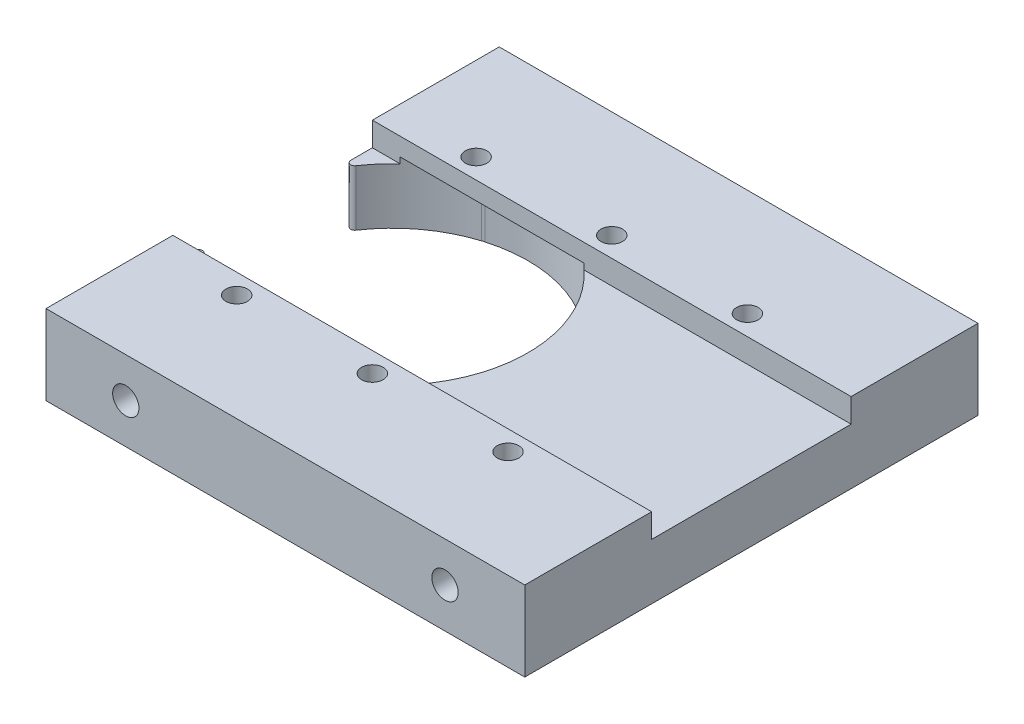
from build123d import *
from build123d.topology import SkipClean

# Parameters (mm, degrees)
EXTRUDE_3_DEPTH     = 7
EXTRUDE_4_DEPTH     = 0.75
EXTRUDE_5_DEPTH     = 0.75
SKETCH_6_W          = 60
SKETCH_6_H          = 15.9
SKETCH_6_R          = 1.35
EXTRUDE_6_DEPTH     = 2.25
SKETCH_7_W          = 60
SKETCH_7_H          = 15.9
SKETCH_7_R          = 1.35
EXTRUDE_7_DEPTH     = 2.25
SKETCH_8_R          = 1.65
CUT_EXTRUDE_1_DEPTH = 5
CUT_EXTRUDE_START   = -5
SKETCH_9_R          = 1.65
CUT_EXTRUDE_2_DEPTH = 5


with BuildPart() as part:
    # 草图1 → 凸台-拉伸3 (new body)
    with BuildSketch(Plane(origin=(0, 0, 0), x_dir=(1, 0, 0), z_dir=(0, 1, 0))):
        with BuildLine():
            Line((-36.072982456, 22.421052632), (-36.072982456, 3.819011603))
            ThreePointArc((-36.072982456, 3.819011603), (-35.719367467, 3.340920159), (-35.158696742, 3.539069918))
            ThreePointArc((-35.158696742, 3.539069918), (-31.213626847, 7.665367614), (-26.125018269, 10.253025221))
            ThreePointArc((-26.125018269, 10.253025221), (-25.960902102, 10.314118117), (-25.79025857, 10.353453131))
            ThreePointArc((-25.79025857, 10.353453131), (-19.301572904, 10.928509809), (-13.072982456, 9.021052632))
            ThreePointArc((-13.072982456, 9.021052632), (-5.321033393, -12.372389376), (-25.79025857, -22.311347868))
            ThreePointArc((-25.79025857, -22.311347868), (-25.960902102, -22.272012853), (-26.125018269, -22.210919958))
            ThreePointArc((-26.125018269, -22.210919958), (-31.213626847, -19.623262351), (-35.158696742, -15.496964655))
            ThreePointArc((-35.158696742, -15.496964655), (-35.719367467, -15.298814896), (-36.072982456, -15.77690634))
            Line((-36.072982456, -15.77690634), (-36.072982456, -34.378947368))
            Line((-36.072982456, -34.378947368), (23.927017544, -34.378947368))
            Line((23.927017544, -34.378947368), (23.927017544, 22.421052632))
            Line((23.927017544, 22.421052632), (-36.072982456, 22.421052632))
        make_face()
    extrude(amount=EXTRUDE_3_DEPTH)

    # 草图5 → 凸台-拉伸4 (add)
    with BuildSketch(Plane(origin=(0, 7, 0), x_dir=(1, 0, 0), z_dir=(0, 1, 0))):
        with BuildLine():
            Line((-36.072982456, -34.378947368), (23.927017544, -34.378947368))
            Line((23.927017544, -34.378947368), (23.927017544, -18.478947368))
            Line((23.927017544, -18.478947368), (-9.551263834, -18.478947368))
            ThreePointArc((-9.551263834, -18.478947368), (-17.168250345, -22.524432165), (-25.79025857, -22.311347868))
            ThreePointArc((-25.79025857, -22.311347868), (-25.960902102, -22.272012853), (-26.125018269, -22.210919958))
            ThreePointArc((-26.125018269, -22.210919958), (-29.567347581, -20.704631092), (-32.594701078, -18.478947368))
            Line((-32.594701078, -18.478947368), (-36.072982456, -18.478947368))
            Line((-36.072982456, -18.478947368), (-36.072982456, -34.378947368))
        make_face()
    extrude(amount=EXTRUDE_4_DEPTH)

    # 草图5<3> → 凸台-拉伸5 (add)
    with BuildSketch(Plane(origin=(0, 7, 0), x_dir=(1, 0, 0), z_dir=(0, 1, 0))):
        with BuildLine():
            Line((-9.551263834, 6.521052632), (23.927017544, 6.521052632))
            Line((23.927017544, 6.521052632), (23.927017544, 22.421052632))
            Line((23.927017544, 22.421052632), (-36.072982456, 22.421052632))
            Line((-36.072982456, 22.421052632), (-36.072982456, 6.521052632))
            Line((-36.072982456, 6.521052632), (-32.594701078, 6.521052632))
            ThreePointArc((-32.594701078, 6.521052632), (-29.567347581, 8.746736355), (-26.125018269, 10.253025221))
            ThreePointArc((-26.125018269, 10.253025221), (-25.960902102, 10.314118117), (-25.79025857, 10.353453131))
            ThreePointArc((-25.79025857, 10.353453131), (-17.168250345, 10.566537428), (-9.551263834, 6.521052632))
        make_face()
    extrude(amount=EXTRUDE_5_DEPTH)

    # 草图6 → 凸台-拉伸6 (add)
    with SkipClean():  # the faces are left unmerged after this step: merging them gives an invalid solid
        with BuildSketch(Plane(origin=(0, 7.75, 0), x_dir=(1, 0, 0), z_dir=(0, 1, 0))):
            with Locations((-6.072982456, -26.428947368)):
                Rectangle(SKETCH_6_W, SKETCH_6_H)
            with Locations((-25.572982456, -20.978947368)):
                Circle(SKETCH_6_R, mode=Mode.SUBTRACT)
            with Locations((-8.572982456, -20.978947368)):
                Circle(SKETCH_6_R, mode=Mode.SUBTRACT)
            with Locations((8.427017544, -20.978947368)):
                Circle(SKETCH_6_R, mode=Mode.SUBTRACT)
        extrude(amount=EXTRUDE_6_DEPTH)

    # 草图7 → 凸台-拉伸7 (add)
    with SkipClean():  # the faces are left unmerged after this step: merging them gives an invalid solid
        with BuildSketch(Plane(origin=(0, 7.75, 0), x_dir=(1, 0, 0), z_dir=(0, 1, 0))):
            with Locations((-6.072982456, 14.471052632)):
                Rectangle(SKETCH_7_W, SKETCH_7_H)
            with Locations((8.427017544, 9.021052632)):
                Circle(SKETCH_7_R, mode=Mode.SUBTRACT)
            with Locations((-8.572982456, 9.021052632)):
                Circle(SKETCH_7_R, mode=Mode.SUBTRACT)
            with Locations((-25.572982456, 9.021052632)):
                Circle(SKETCH_7_R, mode=Mode.SUBTRACT)
        extrude(amount=EXTRUDE_7_DEPTH)

    # 草图8 → 切除-拉伸1 (cut)
    with SkipClean():  # the faces are left unmerged after this step: merging them gives an invalid solid
        with BuildSketch(Plane.XY.offset(34.378947368)):
            with Locations((-26.072982456, 5)):
                Circle(SKETCH_8_R)
            with Locations((13.927017544, 5)):
                Circle(SKETCH_8_R)
        extrude(amount=-CUT_EXTRUDE_1_DEPTH, mode=Mode.SUBTRACT)

    # 草图9 → 切除-拉伸2 (cut)
    with SkipClean():  # the faces are left unmerged after this step: merging them gives an invalid solid
        with BuildSketch(Plane(origin=(0, 0, -22.421052632), x_dir=(-1, 0, 0), z_dir=(0, 0, -1)).offset(CUT_EXTRUDE_START)):
            with Locations((26.072982456, 5)):
                Circle(SKETCH_9_R)
            with Locations((-13.927017544, 5)):
                Circle(SKETCH_9_R)
        extrude(amount=CUT_EXTRUDE_2_DEPTH, mode=Mode.SUBTRACT)


solid = part.part
